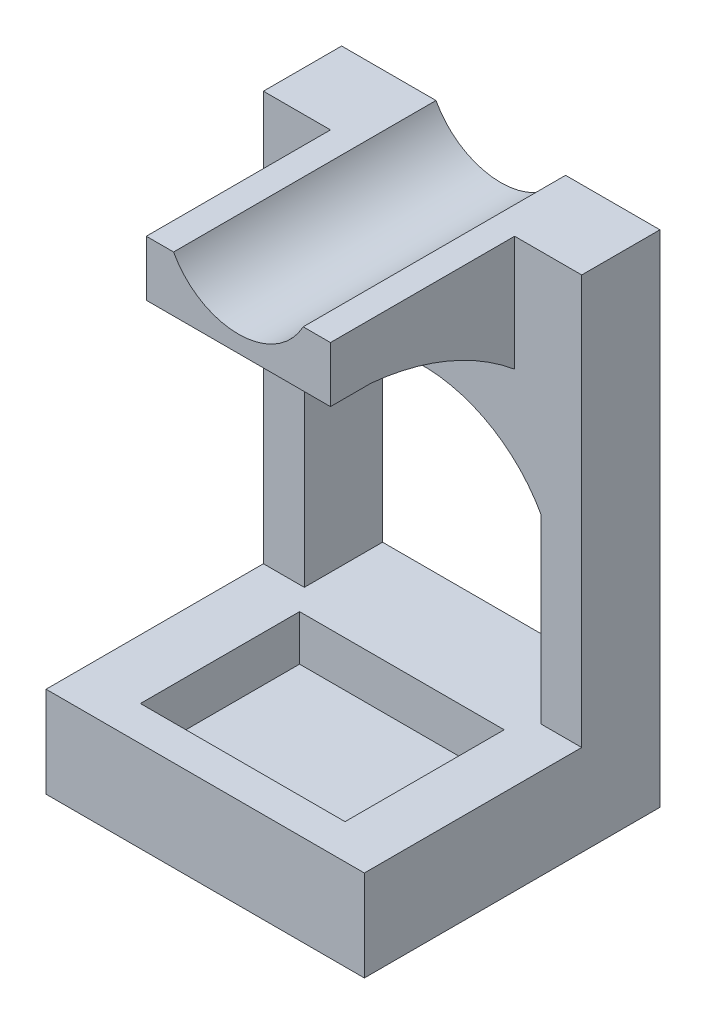
from build123d import *

# Parameters (mm, degrees)
SKETCH1_W               = 70
SKETCH1_H               = 65
BOSS_EXTRUDE1_DEPTH     = 20
SKETCH2_W               = 45
SKETCH2_H               = 35
CUT_EXTRUDE1_DEPTH      = 10
SKETCH3_W               = 70
SKETCH3_H               = 17.205499322
BOSS_EXTRUDE2_DEPTH     = 75
CUT_EXTRUDE2_REACH      = 136.722
CUT_EXTRUDE3_REACH      = 136.722
SKETCH7_W               = 28.5
SKETCH7_H               = 6.302488938
SKETCH8_W               = 70
SKETCH8_H               = 17.205499322
BOSS_EXTRUDE3_DEPTH     = 15
CUT_EXTRUDE4_DEPTH      = 146.688022843
CUT_EXTRUDE4_DEPTH_BACK = 146.688022843
BOSS_EXTRUDE8_START     = 40.5
BOSS_EXTRUDE8_DEPTH     = 40.5
BOSS_EXTRUDE10_DEPTH    = 40.5


with BuildPart() as part:
    # Sketch1 → Boss-Extrude1 (new body)
    with BuildSketch(Plane(origin=(0, 0, 0), x_dir=(1, 0, 0), z_dir=(0, 1, 0))):
        with Locations((35, 32.5)):
            Rectangle(SKETCH1_W, SKETCH1_H)
    extrude(amount=BOSS_EXTRUDE1_DEPTH)

    # Sketch2 → Cut-Extrude1 (cut)
    with BuildSketch(Plane(origin=(0, 20, 0), x_dir=(1, 0, 0), z_dir=(0, 1, 0))):
        with Locations((35.6, 25.150369075)):
            Rectangle(SKETCH2_W, SKETCH2_H)
    extrude(amount=-CUT_EXTRUDE1_DEPTH, mode=Mode.SUBTRACT)

    # Sketch3 → Boss-Extrude2 (add)
    with BuildSketch(Plane(origin=(0, 20, 0), x_dir=(1, 0, 0), z_dir=(0, 1, 0))):
        with Locations((35, 56.397250339)):
            Rectangle(SKETCH3_W, SKETCH3_H)
    extrude(amount=BOSS_EXTRUDE2_DEPTH)

    # Sketch6 → Cut-Extrude2 (cut, up to next)
    with BuildSketch(Plane(origin=(0, 0, -65), x_dir=(-1, 0, 0), z_dir=(0, 0, -1)), mode=Mode.PRIVATE) as cut_extrude2_sk1:
        with BuildLine():
            Line((-61, 60), (-61, 20))
            Line((-61, 20), (-9, 20))
            Line((-9, 20), (-9, 60))
            ThreePointArc((-9, 60), (-35, 75.278971352), (-61, 60))
        make_face()
    cut_extrude2_tool1 = extrude(cut_extrude2_sk1.sketch, amount=-CUT_EXTRUDE2_REACH, mode=Mode.PRIVATE) & part.part
    add(cut_extrude2_tool1.solids().sort_by_distance((35, 45.608619, -65))[0], mode=Mode.SUBTRACT)

    # Sketch7 → Cut-Extrude3 (cut, up to next)
    with BuildSketch(Plane(origin=(0, 95, 0), x_dir=(1, 0, 0), z_dir=(0, 1, 0)), mode=Mode.PRIVATE) as cut_extrude3_sk1:
        with Locations((35, 61.848755531)):
            Rectangle(SKETCH7_W, SKETCH7_H)
    cut_extrude3_tool1 = extrude(cut_extrude3_sk1.sketch, amount=-CUT_EXTRUDE3_REACH, mode=Mode.PRIVATE) & part.part
    add(cut_extrude3_tool1.solids().sort_by_distance((35, 95, -61.848756))[0], mode=Mode.SUBTRACT)

    # Sketch8 → Boss-Extrude3 (add)
    with BuildSketch(Plane(origin=(0, 95, 0), x_dir=(1, 0, 0), z_dir=(0, 1, 0))):
        with Locations((35, 56.397250339)):
            Rectangle(SKETCH8_W, SKETCH8_H)
    extrude(amount=BOSS_EXTRUDE3_DEPTH)

    # Sketch9 → Cut-Extrude4 (cut, two sides: drawn at the far end of the back side and taken through both)
    with BuildSketch(Plane(origin=(0, 0, -65), x_dir=(-1, 0, 0), z_dir=(0, 0, -1)).offset(-CUT_EXTRUDE4_DEPTH_BACK)):
        with BuildLine():
            Line((-168.040562266, 331.160425887), (-49.25, 110))
            ThreePointArc((-49.25, 110), (-35, 101.478526665), (-20.75, 110))
            Line((-20.75, 110), (98.040562266, 331.160425887))
            Line((98.040562266, 331.160425887), (98.040562266, 833.248592098))
            Line((98.040562266, 833.248592098), (-168.040562266, 833.248592098))
            Line((-168.040562266, 833.248592098), (-168.040562266, 331.160425887))
        make_face()
    extrude(amount=CUT_EXTRUDE4_DEPTH + CUT_EXTRUDE4_DEPTH_BACK, mode=Mode.SUBTRACT)

    # Sketch10 → Boss-Extrude8 (add)
    with BuildSketch(Plane.XY.offset(-47.794500678).offset(BOSS_EXTRUDE8_START)):
        with BuildLine():
            Line((49.25, 110), (55.25, 110))
            Line((55.25, 110), (55.25, 97.797353367))
            Line((55.25, 97.797353367), (20.533128671, 97.797353367))
            Line((20.533128671, 97.797353367), (14.75, 97.797353367))
            Line((14.75, 97.797353367), (14.75, 110))
            Line((14.75, 110), (20.75, 110))
            ThreePointArc((20.75, 110), (35, 101.478526665), (49.25, 110))
        make_face()
    extrude(amount=-BOSS_EXTRUDE8_DEPTH)

    # Sketch12 → Boss-Extrude10 (add)
    with BuildSketch(Plane.ZY.offset(-14.75)):
        with BuildLine():
            Line((-16.303904233, 97.797353367), (-47.794500678, 97.797353367))
            Line((-47.794500678, 97.797353367), (-47.794500678, 84.67575775))
            ThreePointArc((-47.794500678, 84.67575775), (-33.03291757, 93.597379394), (-16.303904233, 97.797353367))
        make_face()
    extrude(amount=-BOSS_EXTRUDE10_DEPTH)


solid = part.part
